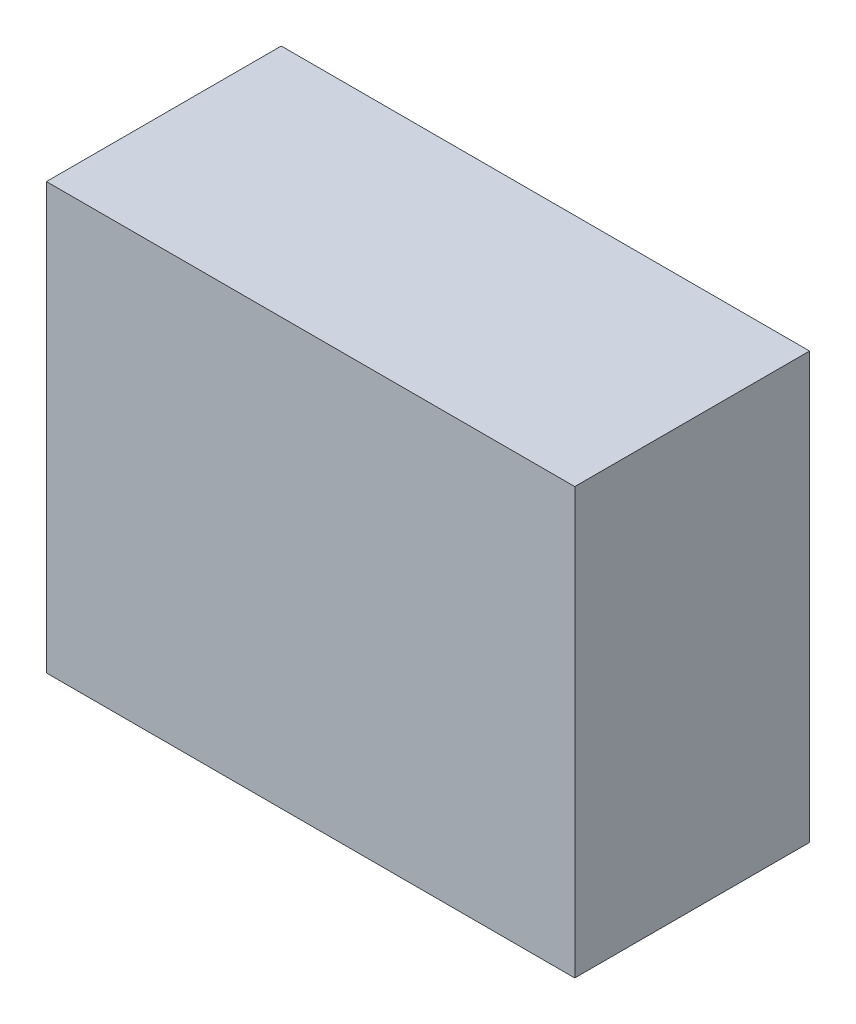
from build123d import *

# Parameters (mm, degrees)
SKETCH1_W           = 457.2
SKETCH1_H           = 368.3
BOSS_EXTRUDE1_DEPTH = 203.2


with BuildPart() as part:
    # Sketch1 → Boss-Extrude1 (new body)
    with BuildSketch(Plane.XY):
        with Locations((-634.571326192, -125.580519006)):
            Rectangle(SKETCH1_W, SKETCH1_H)
    extrude(amount=BOSS_EXTRUDE1_DEPTH)


solid = part.part
